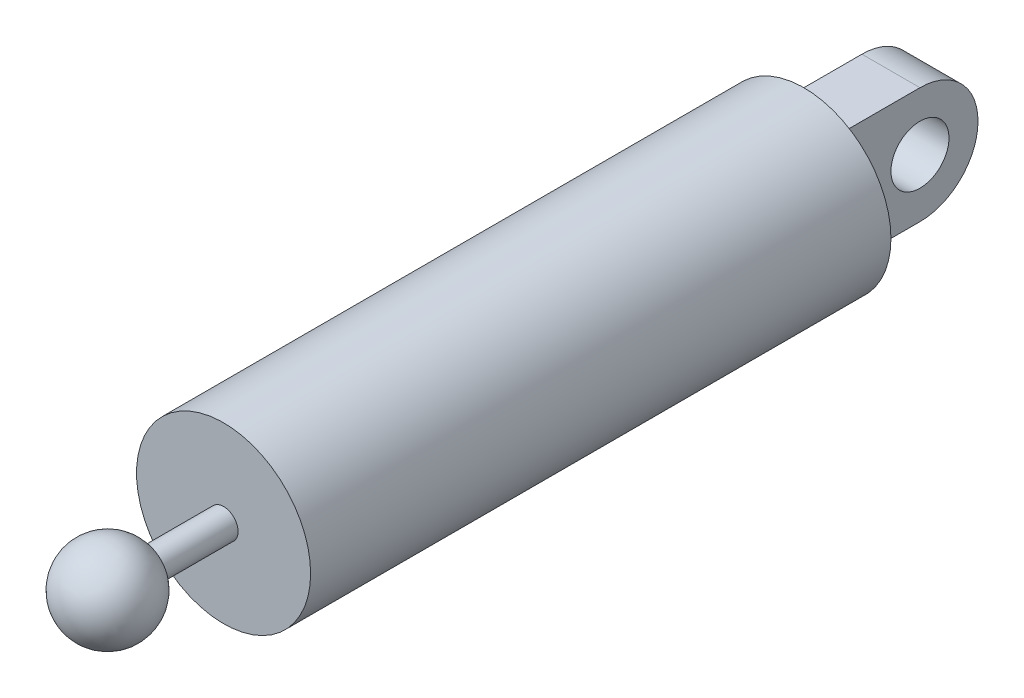
from build123d import *

# Parameters (mm, degrees)
CROQUIS1_R              = 7.5
SALIENTE_EXTRUIR1_DEPTH = 50
CROQUIS4_W              = 5
CROQUIS4_H              = 10
SALIENTE_EXTRUIR2_DEPTH = 12.5
CROQUIS5_R              = 2.5
CORTAR_EXTRUIR1_DEPTH   = 5
CROQUIS6_R              = 1.25
SALIENTE_EXTRUIR3_DEPTH = 10


with BuildPart() as part:
    # Croquis1 → Saliente-Extruir1 (new body)
    with BuildSketch(Plane.XY):
        Circle(CROQUIS1_R)
    extrude(amount=SALIENTE_EXTRUIR1_DEPTH)

    # Croquis4 → Saliente-Extruir2 (add)
    with BuildSketch(Plane(origin=(0, 0, 0), x_dir=(-1, 0, 0), z_dir=(0, 0, -1))):
        Rectangle(CROQUIS4_W, CROQUIS4_H)
    extrude(amount=SALIENTE_EXTRUIR2_DEPTH)

    # Croquis5 → Cortar-Extruir1 (cut)
    with BuildSketch(Plane.ZY.offset(2.5)):
        with BuildLine():
            ThreePointArc((-7.5, -5), (-11.035533906, -3.535533906), (-12.5, 0))
            Line((-12.5, 0), (-12.5, -5))
            Line((-12.5, -5), (-7.5, -5))
        make_face()
        with BuildLine():
            ThreePointArc((-12.5, 0), (-11.035533906, 3.535533906), (-7.5, 5))
            Line((-7.5, 5), (-12.5, 5))
            Line((-12.5, 5), (-12.5, 0))
        make_face()
        with Locations(Location((-7.5, 0, 0), (0, 0, 270))):
            Circle(CROQUIS5_R)
    extrude(amount=-CORTAR_EXTRUIR1_DEPTH, mode=Mode.SUBTRACT)

    # Croquis6 → Saliente-Extruir3 (add)
    with BuildSketch(Plane.XY.offset(50)):
        Circle(CROQUIS6_R)
    extrude(amount=SALIENTE_EXTRUIR3_DEPTH)

    # Croquis7 → Revolución7 (revolve)
    with BuildSketch(Plane.XY.offset(60)):
        with BuildLine():
            Line((0, 3.75), (0, -3.75))
            ThreePointArc((0, -3.75), (3.75, 0), (0, 3.75))
        make_face()
    revolve(axis=Axis((0, 7.5, 60), (0, -1, 0)))


solid = part.part
